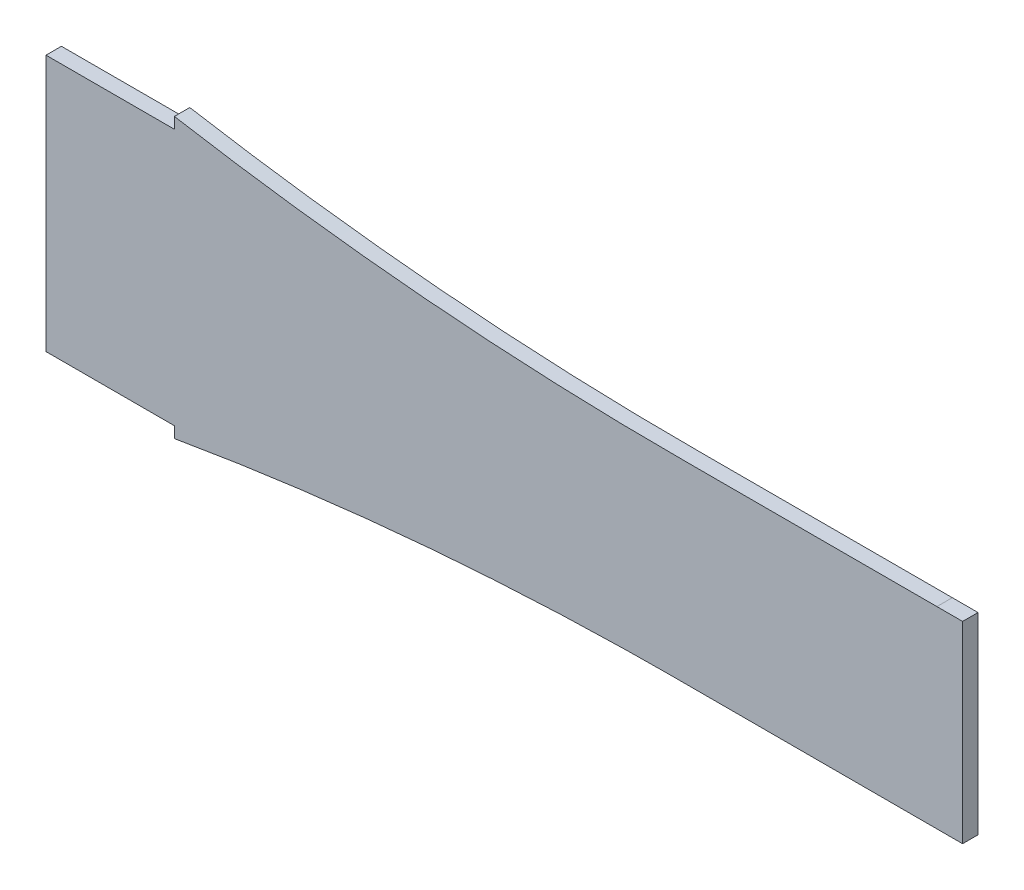
from build123d import *

# Parameters (mm, degrees)
BOSS_EXTRUDE1_DEPTH      = 0.6
BOSS_EXTRUDE1_DEPTH_BACK = 0.6


with BuildPart() as part:
    # Sketch2 → Boss-Extrude1 (new, two sides: drawn at the far end of the back side and taken through both)
    with BuildSketch(Plane.XY.offset(-BOSS_EXTRUDE1_DEPTH_BACK)):
        with BuildLine():
            Line((202.50370257, 13.5), (200.50370257, 13.5))
            add(Edge.make_bspline(
                [(200.50370257, 13.5), (199.074917608, 13.5), (196.922682113, 13.499999988), (194.089266991, 13.50000002), (191.634138002, 13.499999925), (189.047662174, 13.500000282), (185.720042457, 13.499998504), (183.067579699, 13.500009344), (180.929013684, 13.499984023), (179.048732059, 13.500086521), (176.736526724, 13.523104421), (174.091882285, 13.580347526), (171.527736211, 13.665821528), (169.025206506, 13.776285946), (165.740597936, 13.955169806), (161.70908639, 14.239854658), (156.900354592, 14.680391927), (152.026473921, 15.232042325), (147.01490053, 15.903383768), (143.285295207, 16.49131543), (141.26029798, 16.839114396), (141.101357243, 16.866582901)],
                knots=[0.016413233, 0.016413233, 0.016413233, 0.016413233, 0.024097505, 0.02793964, 0.031781776, 0.035623912, 0.039466048, 0.04715032, 0.050992455, 0.054834591, 0.062518863, 0.070203134, 0.077887406, 0.085571678, 0.093255949, 0.108624492, 0.123993036, 0.139361579, 0.154730122, 0.170098665, 0.171403342, 0.171403342, 0.171403342, 0.171403342], degree=3))
            Line((141.101357243, 16.866582901), (141.101357243, 16))
            Line((141.101357243, 16), (131.101357243, 16))
            Line((131.101357243, 16), (131.101357243, -4))
            Line((131.101357243, -4), (141.101357243, -4))
            Line((141.101357243, -4), (141.101357243, -4.866582901))
            add(Edge.make_bspline(
                [(141.101357243, -4.866582901), (141.26029798, -4.839114396), (143.285295207, -4.49131543), (147.01490053, -3.903383768), (152.026473921, -3.232042325), (156.900354592, -2.680391927), (161.70908639, -2.239854658), (165.740597936, -1.955169806), (169.025206506, -1.776285946), (171.527736211, -1.665821528), (174.091882285, -1.580347526), (176.736526724, -1.523104421), (179.048732059, -1.500086521), (180.929013684, -1.499984023), (183.067579699, -1.500009344), (185.720042457, -1.499998504), (189.047662174, -1.500000282), (191.634138002, -1.499999925), (194.089266991, -1.50000002), (196.922682113, -1.499999988), (199.074917608, -1.5), (200.50370257, -1.5)],
                knots=[0.845009891, 0.845009891, 0.845009891, 0.845009891, 0.846314568, 0.861683111, 0.877051654, 0.892420197, 0.907788741, 0.923157284, 0.930841555, 0.938525827, 0.946210099, 0.95389437, 0.961578642, 0.965420778, 0.969262914, 0.976947185, 0.980789321, 0.984631457, 0.988473593, 0.992315728, 1, 1, 1, 1], degree=3))
            Line((200.50370257, -1.5), (202.50370257, -1.5))
            Line((202.50370257, -1.5), (202.50370257, 13.5))
        make_face()
    extrude(amount=BOSS_EXTRUDE1_DEPTH + BOSS_EXTRUDE1_DEPTH_BACK)


solid = part.part
